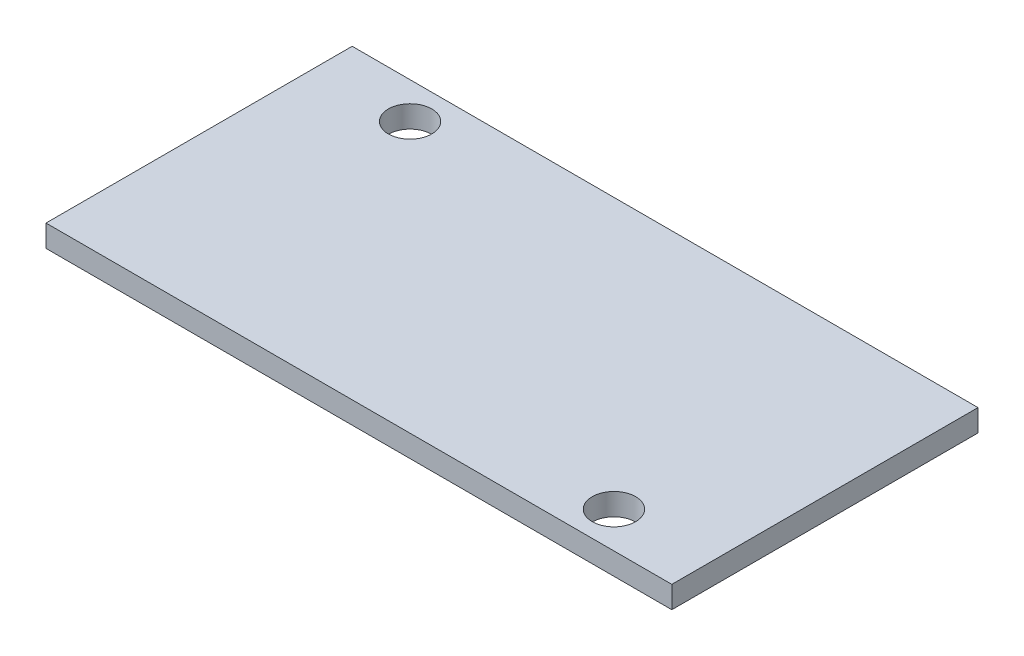
from build123d import *

# Parameters (mm, degrees)
SKETCH1_W           = 43.25
SKETCH1_H           = 21.16
BOSS_EXTRUDE1_DEPTH = 1.52
SKETCH2_R           = 1.5
CUT_EXTRUDE1_DEPTH  = 25.122342859


with BuildPart() as part:
    # Sketch1 → Boss-Extrude1 (new body)
    with BuildSketch(Plane(origin=(0, 0, 0), x_dir=(1, 0, 0), z_dir=(0, 1, 0))):
        Rectangle(SKETCH1_W, SKETCH1_H)
    extrude(amount=BOSS_EXTRUDE1_DEPTH)

    # Sketch2 → Cut-Extrude1 (cut, through all)
    with BuildSketch(Plane(origin=(0, 1.52, 0), x_dir=(1, 0, 0), z_dir=(0, 1, 0))):
        with Locations(Location((-15.125, 8.08, 0), (0, 0, 270))):
            Circle(SKETCH2_R)
        with Locations(Location((15.125, -8.08, 0), (0, 0, 270))):
            Circle(SKETCH2_R)
    extrude(amount=-CUT_EXTRUDE1_DEPTH, mode=Mode.SUBTRACT)


solid = part.part
